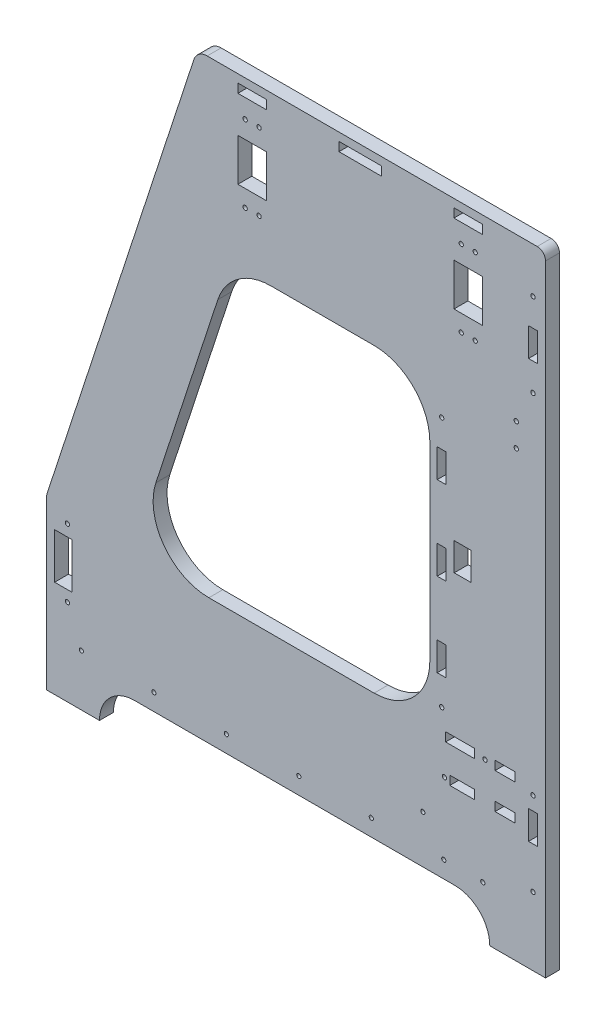
from build123d import *

# Parameters (mm, degrees)
SZKIC1_W                    = 358
SZKIC1_H                    = 451.5
DODANIE_WYCI_GNI_CIE1_DEPTH = 10
WYTNIJ_WYCI_GNI_CIE1_DEPTH  = 10
WYTNIJ_WYCI_GNI_CIE2_DEPTH  = 10
WYTNIJ_WYCI_GNI_CIE3_DEPTH  = 10
SZKIC8_W                    = 6.4
SZKIC8_H                    = 20.4
WYTNIJ_WYCI_GNI_CIE4_DEPTH  = 10
SZYK_LINIOWY1_COUNT         = 2
SZYK_LINIOWY1_PITCH         = 300
SZKIC9_R                    = 1.55
WYTNIJ_WYCI_GNI_CIE5_DEPTH  = 10
SZYK_LINIOWY2_COUNT         = 2
SZYK_LINIOWY2_PITCH         = 60
SZYK_LINIOWY2_COUNT_DIR2    = 2
SZYK_LINIOWY2_PITCH_DIR2    = 310
WYTNIJ_WYCI_GNI_CIE6_DEPTH  = 794.025959913
SZKIC12_R                   = 1.55
WYTNIJ_WYCI_GNI_CIE7_DEPTH  = 10
SZKIC15_R                   = 1.5
WYTNIJ_WYCI_GNI_CIE9_DEPTH  = 10
SZKIC17_R                   = 1.55
WYTNIJ_WYCI_GNI_CIE10_DEPTH = 10
SZKIC19_W                   = 20.4
SZKIC19_H                   = 6.4
SZKIC19_W_2                 = 30.4
WYTNIJ_WYCI_GNI_CIE11_DEPTH = 10
SZKIC23_R                   = 1.55
SZKIC23_W                   = 14.4
SZKIC23_H                   = 6.4
SZKIC23_W_2                 = 17.9
WYTNIJ_WYCI_GNI_CIE12_DEPTH = 10
SZKIC31_R                   = 1.55
WYTNIJ_WYCI_GNI_CIE15_DEPTH = 10
SZYK_LINIOWY3_COUNT         = 2
SZYK_LINIOWY3_PITCH         = 180
SZKIC33_W                   = 6.4
SZKIC33_H                   = 20.4
WYTNIJ_WYCI_GNI_CIE16_DEPTH = 10
SZYK_LINIOWY4_COUNT         = 3
SZYK_LINIOWY4_PITCH         = 60
SZKIC35_R                   = 1.55
SZKIC35_W                   = 20.9
SZKIC35_H                   = 6.4
SZKIC35_W_2                 = 14.4
WYTNIJ_WYCI_GNI_CIE17_DEPTH = 10
SZYK_LINIOWY5_COUNT         = 2
SZYK_LINIOWY5_PITCH         = 155
WYTNIJ_WYCI_GNI_CIE18_DEPTH = 10
SZKIC37_W                   = 12
SZKIC37_H                   = 20
WYTNIJ_WYCI_GNI_CIE19_DEPTH = 10
SZKIC39_R                   = 1.55
WYTNIJ_WYCI_GNI_CIE21_DEPTH = 10


with BuildPart() as part:
    # Szkic1 → Dodanie-wyciągnięcie1 (new body)
    with BuildSketch(Plane.XY):
        with Locations((-429.368459045, -282.853962956)):
            Rectangle(SZKIC1_W, SZKIC1_H)
    extrude(amount=DODANIE_WYCI_GNI_CIE1_DEPTH)

    # Szkic2 → Wytnij-wyciągnięcie1 (cut)
    with BuildSketch(Plane(origin=(0, 0, 0), x_dir=(-1, 0, 0), z_dir=(0, 0, -1))):
        Polygon((608.368459045, -387.603962956), (500.368459045, -57.103962956), (608.368459045, -57.103962956), align=None)
    extrude(amount=-WYTNIJ_WYCI_GNI_CIE1_DEPTH, mode=Mode.SUBTRACT)

    # Szkic3 → Wytnij-wyciągnięcie2 (cut)
    with BuildSketch(Plane.XY.offset(10)):
        with BuildLine():
            Line((-570.368459045, -508.603962956), (-290.368459045, -508.603962956))
            ThreePointArc((-290.368459045, -508.603962956), (-297.690789516, -490.926293426), (-315.368459045, -483.603962956))
            Line((-315.368459045, -483.603962956), (-545.368459045, -483.603962956))
            ThreePointArc((-545.368459045, -483.603962956), (-563.046128575, -490.926293426), (-570.368459045, -508.603962956))
        make_face()
    extrude(amount=-WYTNIJ_WYCI_GNI_CIE2_DEPTH, mode=Mode.SUBTRACT)

    # Szkic4 → Wytnij-wyciągnięcie3 (cut)
    with BuildSketch(Plane.XY.offset(10)):
        with BuildLine():
            Line((-491.890848015, -393.103962956), (-373.368459045, -393.103962956))
            ThreePointArc((-373.368459045, -393.103962956), (-345.084187798, -381.388234203), (-333.368459045, -353.103962956))
            Line((-333.368459045, -353.103962956), (-333.368459045, -217.103962956))
            ThreePointArc((-333.368459045, -217.103962956), (-345.084187798, -188.819691708), (-373.368459045, -177.103962956))
            Line((-373.368459045, -177.103962956), (-447.449093098, -177.103962956))
            ThreePointArc((-447.449093098, -177.103962956), (-470.93331873, -184.723549949), (-485.470539353, -204.679405632))
            Line((-485.470539353, -204.679405632), (-529.91229427, -340.679405632))
            ThreePointArc((-529.91229427, -340.679405632), (-524.271261022, -376.588188587), (-491.890848015, -393.103962956))
        make_face()
    extrude(amount=-WYTNIJ_WYCI_GNI_CIE3_DEPTH, mode=Mode.SUBTRACT)

    # Szkic8 → Wytnij-wyciągnięcie4 (cut)
    with BuildSketch(Plane.XY.offset(10)):
        with Locations((-259.368459045, -119.603962956)):
            Rectangle(SZKIC8_W, SZKIC8_H)
    wytnij_wyci_gni_cie4 = extrude(amount=-WYTNIJ_WYCI_GNI_CIE4_DEPTH, mode=Mode.SUBTRACT)

    # Szyk liniowy1: Wytnij-wyciągnięcie4 ×2
    with Locations(*[(0, -i * SZYK_LINIOWY1_PITCH, 0) for i in range(1, SZYK_LINIOWY1_COUNT)]):
        add(wytnij_wyci_gni_cie4, mode=Mode.SUBTRACT)

    # Szkic9 → Wytnij-wyciągnięcie5 (cut)
    with BuildSketch(Plane.XY.offset(10)):
        with Locations((-259.368459045, -89.603962956)):
            Circle(SZKIC9_R)
    wytnij_wyci_gni_cie5 = extrude(amount=-WYTNIJ_WYCI_GNI_CIE5_DEPTH, mode=Mode.SUBTRACT)

    # Szyk liniowy2: Wytnij-wyci_gni_cie5 2 × 2
    with Locations(*[Vector(0, -1, 0) * (i * SZYK_LINIOWY2_PITCH) + Vector(0, -1, 0) * (j * SZYK_LINIOWY2_PITCH_DIR2) for i in range(SZYK_LINIOWY2_COUNT) for j in range(SZYK_LINIOWY2_COUNT_DIR2) if (i, j) != (0, 0)]):
        add(wytnij_wyci_gni_cie5, mode=Mode.SUBTRACT)

    # Szkic10 → Wytnij-wyciągnięcie6 (cut, through all)
    with BuildSketch(Plane.XY.offset(10)):
        with BuildLine():
            Line((-256.368459045, -57.103962956), (-250.368459045, -57.103962956))
            Line((-250.368459045, -57.103962956), (-250.368459045, -63.103962956))
            ThreePointArc((-250.368459045, -63.103962956), (-252.125818358, -58.861322269), (-256.368459045, -57.103962956))
        make_face()
        with BuildLine():
            Line((-502.621218356, -63.997823625), (-500.368459045, -57.103962956))
            Line((-500.368459045, -57.103962956), (-493.115856793, -57.103962956))
            ThreePointArc((-493.115856793, -57.103962956), (-498.986913201, -59.008859704), (-502.621218356, -63.997823625))
        make_face()
    extrude(amount=-WYTNIJ_WYCI_GNI_CIE6_DEPTH, mode=Mode.SUBTRACT)

    # Szkic12 → Wytnij-wyciągnięcie7 (cut)
    with BuildSketch(Plane.XY.offset(10)):
        with Locations((-593.368459045, -397.873962956)):
            Circle(SZKIC12_R)
        with Locations((-593.368459045, -446.553962956)):
            Circle(SZKIC12_R)
        Polygon((-602.568459045, -406.123962956), (-602.568459045, -438.803962956), (-596.368459045, -438.803962956), (-590.168459045, -438.803962956), (-590.168459045, -406.123962956), (-596.368459045, -406.123962956), align=None)
    extrude(amount=-WYTNIJ_WYCI_GNI_CIE7_DEPTH, mode=Mode.SUBTRACT)

    # Szkic15 → Wytnij-wyciągnięcie9 (cut)
    with BuildSketch(Plane.XY.offset(10)):
        with Locations((-295.368459045, -471.603962956)):
            Circle(SZKIC15_R)
        with Locations((-323.368459045, -471.603962956)):
            Circle(SZKIC15_R)
        with Locations((-375.368459045, -471.603962956)):
            Circle(SZKIC15_R)
        with Locations((-427.368459045, -471.603962956)):
            Circle(SZKIC15_R)
        with Locations((-479.368459045, -471.603962956)):
            Circle(SZKIC15_R)
        with Locations((-531.368459045, -471.603962956)):
            Circle(SZKIC15_R)
        with Locations((-583.368459045, -471.603962956)):
            Circle(SZKIC15_R)
        with Locations((-338.368459045, -449.412668339)):
            Circle(SZKIC15_R)
    extrude(amount=-WYTNIJ_WYCI_GNI_CIE9_DEPTH, mode=Mode.SUBTRACT)

    # Szkic17 → Wytnij-wyciągnięcie10 (cut)
    with BuildSketch(Plane.XY.offset(10)):
        with Locations((-300.868459045, -82.814883616)):
            Circle(SZKIC17_R)
        with Locations((-310.868459045, -82.814883616)):
            Circle(SZKIC17_R)
        with Locations((-300.868459045, -137.814883616)):
            Circle(SZKIC17_R)
        with Locations((-310.868459045, -137.814883616)):
            Circle(SZKIC17_R)
        Polygon((-305.868459045, -95.403962953), (-316.068459045, -95.403962953), (-316.068459045, -125.803962953), (-305.868459045, -125.803962953), (-295.668459045, -125.803962953), (-295.668459045, -95.403962953), align=None)
    wytnij_wyci_gni_cie10 = extrude(amount=-WYTNIJ_WYCI_GNI_CIE10_DEPTH, mode=Mode.SUBTRACT)

    # Szkic19 → Wytnij-wyciągnięcie11 (cut)
    with BuildSketch(Plane.XY.offset(10)):
        with Locations((-305.868459045, -66.103962956)):
            Rectangle(SZKIC19_W, SZKIC19_H)
        with Locations((-383.368459045, -66.103962956)):
            Rectangle(SZKIC19_W_2, SZKIC19_H)
        with Locations((-460.868459045, -66.103962956)):
            Rectangle(SZKIC19_W, SZKIC19_H)
    extrude(amount=-WYTNIJ_WYCI_GNI_CIE11_DEPTH, mode=Mode.SUBTRACT)

    # Szkic23 → Wytnij-wyciągnięcie12 (cut)
    with BuildSketch(Plane.XY.offset(10)):
        with Locations((-322.868459045, -420.103962956)):
            Circle(SZKIC23_R)
        with Locations((-279.368459045, -420.103962956)):
            Rectangle(SZKIC23_W, SZKIC23_H)
        with Locations((-310.118459045, -420.103962956)):
            Rectangle(SZKIC23_W_2, SZKIC23_H)
    extrude(amount=-WYTNIJ_WYCI_GNI_CIE12_DEPTH, mode=Mode.SUBTRACT)

    # Szkic31 → Wytnij-wyciągnięcie15 (cut)
    with BuildSketch(Plane(origin=(0, 0, 0), x_dir=(-1, 0, 0), z_dir=(0, 0, -1))):
        with Locations((324.868459045, -377.603962956)):
            Circle(SZKIC31_R)
    wytnij_wyci_gni_cie15 = extrude(amount=-WYTNIJ_WYCI_GNI_CIE15_DEPTH, mode=Mode.SUBTRACT)

    # Szyk liniowy3: Wytnij-wyciągnięcie15 ×2
    with Locations(*[(0, i * SZYK_LINIOWY3_PITCH, 0) for i in range(1, SZYK_LINIOWY3_COUNT)]):
        add(wytnij_wyci_gni_cie15, mode=Mode.SUBTRACT)

    # Szkic33 → Wytnij-wyciągnięcie16 (cut)
    with BuildSketch(Plane(origin=(0, 0, 0), x_dir=(-1, 0, 0), z_dir=(0, 0, -1))):
        with Locations((324.868459045, -347.603962956)):
            Rectangle(SZKIC33_W, SZKIC33_H)
    wytnij_wyci_gni_cie16 = extrude(amount=-WYTNIJ_WYCI_GNI_CIE16_DEPTH, mode=Mode.SUBTRACT)

    # Szyk liniowy4: Wytnij-wyciągnięcie16 ×3
    with Locations(*[(0, i * SZYK_LINIOWY4_PITCH, 0) for i in range(1, SZYK_LINIOWY4_COUNT)]):
        add(wytnij_wyci_gni_cie16, mode=Mode.SUBTRACT)

    # Szkic35 → Wytnij-wyciągnięcie17 (cut)
    with BuildSketch(Plane(origin=(0, 0, 0), x_dir=(-1, 0, 0), z_dir=(0, 0, -1))):
        with Locations((293.818459045, -394.603962956)):
            Circle(SZKIC35_R)
        with Locations((311.618459045, -394.603962956)):
            Rectangle(SZKIC35_W, SZKIC35_H)
        with Locations((279.368459045, -394.603962956)):
            Rectangle(SZKIC35_W_2, SZKIC35_H)
    extrude(amount=-WYTNIJ_WYCI_GNI_CIE17_DEPTH, mode=Mode.SUBTRACT)

    # Szyk liniowy5: Wytnij-wyciągnięcie10 ×2
    with Locations(*[(-i * SZYK_LINIOWY5_PITCH, 0, 0) for i in range(1, SZYK_LINIOWY5_COUNT)]):
        add(wytnij_wyci_gni_cie10, mode=Mode.SUBTRACT)

    # Szkic36 → Wytnij-wyciągnięcie18 (cut)
    with BuildSketch(Plane(origin=(0, 0, 0), x_dir=(-1, 0, 0), z_dir=(0, 0, -1))):
        with BuildLine():
            Line((607.873820609, -386.090277741), (608.368459045, -387.603962956))
            Line((608.368459045, -387.603962956), (608.368459045, -389.196417072))
            ThreePointArc((608.368459045, -389.196417072), (608.244025248, -387.623778467), (607.873820609, -386.090277741))
        make_face()
    extrude(amount=-WYTNIJ_WYCI_GNI_CIE18_DEPTH, mode=Mode.SUBTRACT)

    # Szkic37 → Wytnij-wyciągnięcie19 (cut)
    with BuildSketch(Plane(origin=(0, 0, 0), x_dir=(-1, 0, 0), z_dir=(0, 0, -1))):
        with Locations((309.868459045, -279.603962956)):
            Rectangle(SZKIC37_W, SZKIC37_H)
    extrude(amount=-WYTNIJ_WYCI_GNI_CIE19_DEPTH, mode=Mode.SUBTRACT)

    # Szkic39 → Wytnij-wyciągnięcie21 (cut)
    with BuildSketch(Plane(origin=(0, 0, 0), x_dir=(-1, 0, 0), z_dir=(0, 0, -1))):
        with Locations((271.368459045, -190.053962956)):
            Circle(SZKIC39_R)
        with Locations((271.368459045, -173.153962956)):
            Circle(SZKIC39_R)
    extrude(amount=-WYTNIJ_WYCI_GNI_CIE21_DEPTH, mode=Mode.SUBTRACT)


solid = part.part
